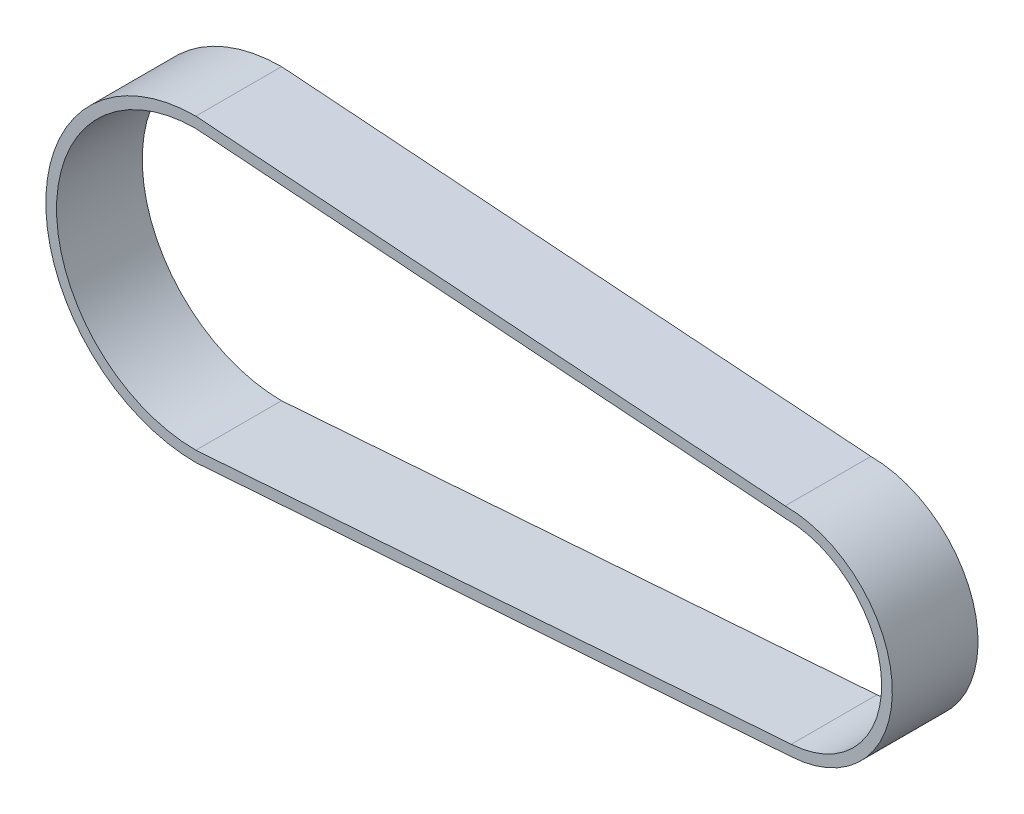
from build123d import *

# Parameters (mm, degrees)
BOSS_EXTRU_1_DEPTH = 8


with BuildPart() as part:
    # Esquisse1 → Boss.-Extru.1 (new body)
    with BuildSketch(Plane.XY):
        with BuildLine():
            Line((-30, -14), (25.567060542, -9.983909171))
            ThreePointArc((25.567060542, -9.983909171), (34.995976483, 0.283644396), (25, 10))
            Line((25, 10), (-30, 14))
            ThreePointArc((-30, 14), (-44, 0), (-30, -14))
        make_face()
        with BuildLine():
            Line((-30, 13), (25, 9))
            ThreePointArc((25, 9), (33.995528369, 0.283671213), (25.567060542, -8.982117921))
            Line((25.567060542, -8.982117921), (-30, -13))
            ThreePointArc((-30, -13), (-43, 0), (-30, 13))
        make_face(mode=Mode.SUBTRACT)
    extrude(amount=BOSS_EXTRU_1_DEPTH)


solid = part.part
